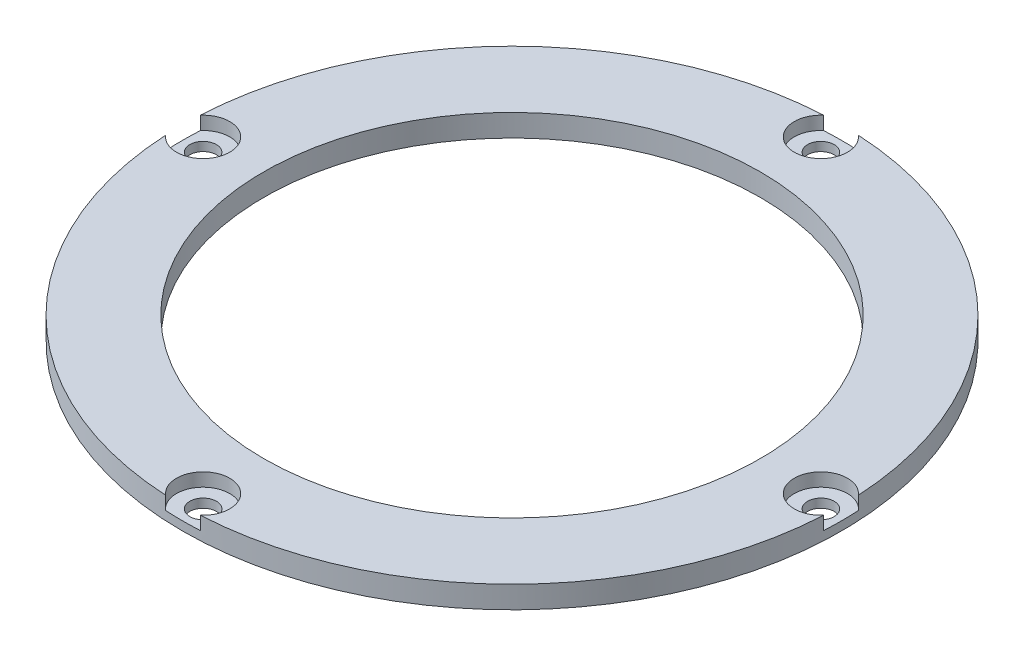
from build123d import *

# Parameters (mm, degrees)
SKETCH_1_R          = 37.15
SKETCH_1_R_2        = 28
SKETCH_1_R_3        = 1.5
EXTRUDE_1_DEPTH     = 3
SKETCH_3_R          = 3
CUT_EXTRUDE_1_DEPTH = 2
CUT_EXTRUDE_START   = -0.5
SKETCH_4_R          = 37.15
CUT_EXTRUDE_2_DEPTH = 0.5


with BuildPart() as part:
    # 草图1 → 凸台-拉伸1 (new body)
    with BuildSketch(Plane(origin=(0, 0, 0), x_dir=(1, 0, 0), z_dir=(0, 1, 0))):
        with Locations(Location((0, 0, 0), (0, 0, 270))):
            Circle(SKETCH_1_R)
        with Locations(Location((0, 0, 0), (0, 0, 270))):
            Circle(SKETCH_1_R_2, mode=Mode.SUBTRACT)
        with Locations(Location((0, 34.825, 0), (0, 0, 270))):
            Circle(SKETCH_1_R_3, mode=Mode.SUBTRACT)
        with Locations(Location((-34.825, 0, 0), (0, 0, 270))):
            Circle(SKETCH_1_R_3, mode=Mode.SUBTRACT)
        with Locations(Location((0, -34.825, 0), (0, 0, 270))):
            Circle(SKETCH_1_R_3, mode=Mode.SUBTRACT)
        with Locations(Location((34.825, 0, 0), (0, 0, 270))):
            Circle(SKETCH_1_R_3, mode=Mode.SUBTRACT)
    extrude(amount=EXTRUDE_1_DEPTH)

    # 草图3 → 切除-拉伸1 (cut)
    with BuildSketch(Plane(origin=(0, 3, 0), x_dir=(1, 0, 0), z_dir=(0, 1, 0))):
        with Locations((0, 34.825)):
            Circle(SKETCH_3_R)
        with Locations((-34.825, 0)):
            Circle(SKETCH_3_R)
        with Locations((0, -34.825)):
            Circle(SKETCH_3_R)
        with Locations((34.825, 0)):
            Circle(SKETCH_3_R)
    extrude(amount=-CUT_EXTRUDE_1_DEPTH, mode=Mode.SUBTRACT)

    # 草图4 → 切除-拉伸2 (cut)
    with BuildSketch(Plane(origin=(0, 3, 0), x_dir=(1, 0, 0), z_dir=(0, 1, 0)).offset(CUT_EXTRUDE_START)):
        with Locations(Location((0, 0, 0), (0, 0, 93.02036647))):
            Circle(SKETCH_4_R)
    extrude(amount=CUT_EXTRUDE_2_DEPTH, mode=Mode.SUBTRACT)


solid = part.part
